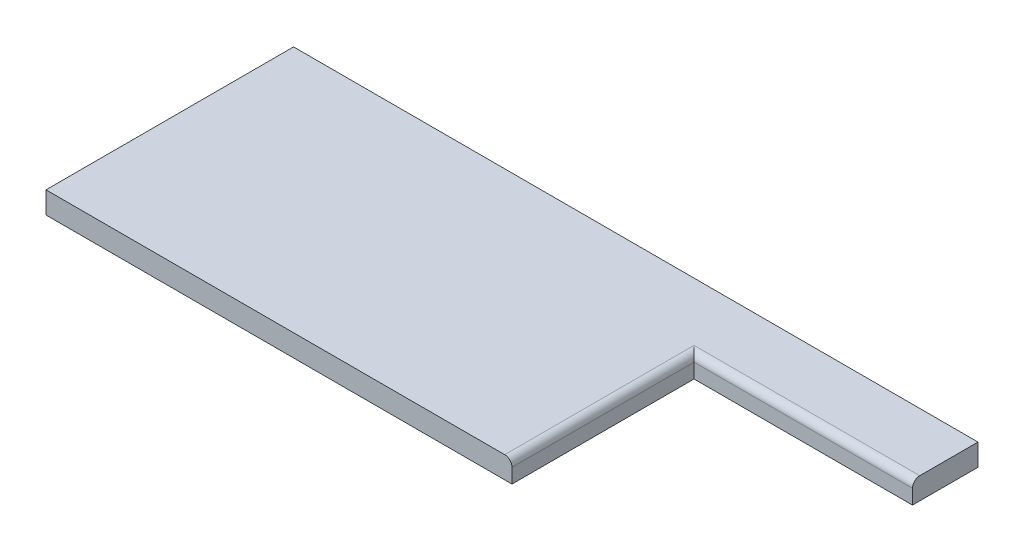
from build123d import *

# Parameters (mm, degrees)
SKETCH1_W           = 188
SKETCH1_H           = 68
BOSS_EXTRUDE1_DEPTH = 6
SKETCH2_W           = 60
SKETCH2_H           = 50
CUT_EXTRUDE1_DEPTH  = 201.00999975
FILLET2_R           = 2


with BuildPart() as part:
    # Sketch1 → Boss-Extrude1 (new body)
    with BuildSketch(Plane(origin=(0, 0, 0), x_dir=(1, 0, 0), z_dir=(0, 1, 0))):
        with Locations((94, 34)):
            Rectangle(SKETCH1_W, SKETCH1_H)
    extrude(amount=BOSS_EXTRUDE1_DEPTH)

    # Sketch2 → Cut-Extrude1 (cut, through all)
    with BuildSketch(Plane(origin=(0, 6, 0), x_dir=(1, 0, 0), z_dir=(0, 1, 0))):
        with Locations((158, 25)):
            Rectangle(SKETCH2_W, SKETCH2_H)
    extrude(amount=-CUT_EXTRUDE1_DEPTH, mode=Mode.SUBTRACT)

    # Fillet2
    fillet2_edges = [part.edges().sort_by_distance(p)[0] for p in [
        (158, 6, -50),
        (128, 6, -25),
    ]]
    fillet(fillet2_edges, radius=FILLET2_R)


solid = part.part
